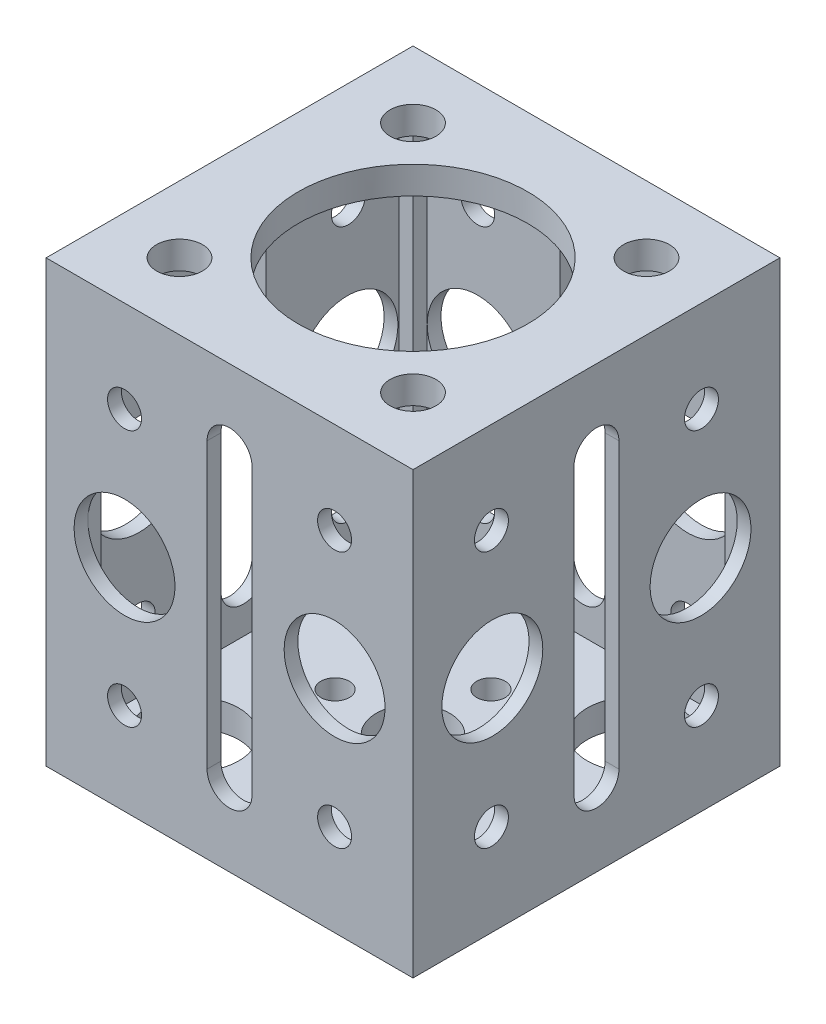
from build123d import *

# Parameters (mm, degrees)
SKETCH_1_W                = 40
SKETCH_1_H                = 40
SKETCH_1_R                = 1.55
EXTRUDE_2_DEPTH           = 3
SKETCH_1_6_R              = 4
CUT_EXTRUDE_1_DEPTH       = 1.5
SKETCH_2_W                = 3
SKETCH_2_H                = 3
EXTRUDE_7_DEPTH           = 45
SKETCH_5_W                = 40
SKETCH_5_H                = 3
EXTRUDE_8_DEPTH           = 40
CUT_EXTRUDE_2_DEPTH       = 4
CUT_EXTRUDE_START         = -4
SKETCH_7_R                = 4
CUT_EXTRUDE_3_DEPTH       = 4
SKETCH_8_R                = 5
CUT_EXTRUDE_4_DEPTH       = 4
SKETCH_9_R                = 2.5
CUT_EXTRUDE_5_DEPTH       = 4
SKETCH_10_W               = 1.5
SKETCH_10_H               = 34
SKETCH_10_W_2             = 34
SKETCH_10_H_2             = 1.5
EXTRUDE_10_DEPTH          = 45
CUT_EXTRUDE_12_DEPTH      = 63.507999488
CUT_EXTRUDE_12_DEPTH_BACK = 4
CUT_EXTRUDE_13_DEPTH      = 4
CUT_EXTRUDE_13_DEPTH_BACK = 64.442887702
CUT_EXTRUDE_15_DEPTH      = 10
CUT_EXTRUDE_15_DEPTH_BACK = 64.442887702
SKETCH_24_5_R             = 1.85
SKETCH_24_5_R_2           = 5.5
CUT_EXTRUDE_16_DEPTH      = 10
CUT_EXTRUDE_16_DEPTH_BACK = 64.442887702
SKETCH_25_R               = 5.5
SKETCH_25_R_2             = 1.85


with BuildPart() as part:
    # 草图1 → 凸台-拉伸2 (new body)
    with BuildSketch(Plane(origin=(0, 0, 0), x_dir=(1, 0, 0), z_dir=(0, 1, 0))):
        Rectangle(SKETCH_1_W, SKETCH_1_H)
        with Locations((0, 8.5)):
            Circle(SKETCH_1_R, mode=Mode.SUBTRACT)
        with Locations((8.5, 0)):
            Circle(SKETCH_1_R, mode=Mode.SUBTRACT)
        with Locations((0, -8.5)):
            Circle(SKETCH_1_R, mode=Mode.SUBTRACT)
        with Locations((-8.5, 0)):
            Circle(SKETCH_1_R, mode=Mode.SUBTRACT)
    extrude(amount=-EXTRUDE_2_DEPTH)

    # 草图1<6> → 切除-拉伸1 (cut)
    with BuildSketch(Plane(origin=(0, 0, 0), x_dir=(1, 0, 0), z_dir=(0, 1, 0))):
        Circle(SKETCH_1_6_R)
    extrude(amount=-CUT_EXTRUDE_1_DEPTH, mode=Mode.SUBTRACT)

    # 草图2 → 凸台-拉伸7 (add)
    with BuildSketch(Plane(origin=(0, 0, 0), x_dir=(1, 0, 0), z_dir=(0, 1, 0))):
        with Locations((-18.5, -18.5)):
            Rectangle(SKETCH_2_W, SKETCH_2_H)
        with Locations((18.5, -18.5)):
            Rectangle(SKETCH_2_W, SKETCH_2_H)
        with Locations((-18.5, 18.5)):
            Rectangle(SKETCH_2_W, SKETCH_2_H)
        with Locations((18.5, 18.5)):
            Rectangle(SKETCH_2_W, SKETCH_2_H)
    extrude(amount=EXTRUDE_7_DEPTH)

    # 草图5 → 凸台-拉伸8 (add)
    with BuildSketch(Plane.ZY.offset(20)):
        with Locations((0, 43.5)):
            Rectangle(SKETCH_5_W, SKETCH_5_H)
    extrude(amount=-EXTRUDE_8_DEPTH)

    # 草图6 → 切除-拉伸2 (cut)
    with BuildSketch(Plane(origin=(0, 45, 0), x_dir=(1, 0, 0), z_dir=(0, 1, 0))):
        with BuildLine():
            ThreePointArc((12.5, 0), (-8.838834765, 8.838834765), (0, -12.5))
            ThreePointArc((0, -12.5), (8.838834765, -8.838834765), (12.5, 0))
        make_face()
    extrude(amount=-CUT_EXTRUDE_2_DEPTH, mode=Mode.SUBTRACT)

    # 草图7 → 切除-拉伸3 (cut)
    with BuildSketch(Plane.XZ.offset(3).offset(CUT_EXTRUDE_START)):
        Circle(SKETCH_7_R)
    extrude(amount=CUT_EXTRUDE_3_DEPTH, mode=Mode.SUBTRACT)

    # 草图8 → 切除-拉伸4 (cut)
    with BuildSketch(Plane.XZ.offset(3)):
        with Locations((-12, 12)):
            Circle(SKETCH_8_R)
        with Locations((12, 12)):
            Circle(SKETCH_8_R)
        with Locations((12, -12)):
            Circle(SKETCH_8_R)
        with Locations((-12, -12)):
            Circle(SKETCH_8_R)
    extrude(amount=-CUT_EXTRUDE_4_DEPTH, mode=Mode.SUBTRACT)

    # 草图9 → 切除-拉伸5 (cut)
    with BuildSketch(Plane(origin=(0, 45, 0), x_dir=(1, 0, 0), z_dir=(0, 1, 0))):
        with Locations((-12.727922061, 12.727922061)):
            Circle(SKETCH_9_R)
        with Locations((12.727922061, 12.727922061)):
            Circle(SKETCH_9_R)
        with Locations((12.727922061, -12.727922061)):
            Circle(SKETCH_9_R)
        with Locations((-12.727922061, -12.727922061)):
            Circle(SKETCH_9_R)
    extrude(amount=-CUT_EXTRUDE_5_DEPTH, mode=Mode.SUBTRACT)

    # 草图10 → 凸台-拉伸10 (add)
    with BuildSketch(Plane(origin=(0, 0, 0), x_dir=(1, 0, 0), z_dir=(0, 1, 0))):
        with Locations((19.25, 0)):
            Rectangle(SKETCH_10_W, SKETCH_10_H)
        with Locations((0, -19.25)):
            Rectangle(SKETCH_10_W_2, SKETCH_10_H_2)
        with Locations((-19.25, 0)):
            Rectangle(SKETCH_10_W, SKETCH_10_H)
        with Locations((0, 19.25)):
            Rectangle(SKETCH_10_W_2, SKETCH_10_H_2)
    extrude(amount=EXTRUDE_10_DEPTH)

    # 草图20 → 切除-拉伸12 (cut, two sides: drawn at the far end of the back side and taken through both)
    with BuildSketch(Plane(origin=(0, 0, 18.5), x_dir=(-1, 0, 0), z_dir=(0, 0, -1)).offset(-CUT_EXTRUDE_12_DEPTH_BACK)):
        with BuildLine():
            Line((-2.45, 36.5), (-2.45, 5.5))
            ThreePointArc((-2.45, 5.5), (0, 3.05), (2.45, 5.5))
            Line((2.45, 5.5), (2.45, 36.5))
            ThreePointArc((2.45, 36.5), (0, 38.95), (-2.45, 36.5))
        make_face()
    extrude(amount=CUT_EXTRUDE_12_DEPTH + CUT_EXTRUDE_12_DEPTH_BACK, mode=Mode.SUBTRACT)

    # 草图24 → 切除-拉伸13 (cut, two sides: drawn at the far end of the back side and taken through both)
    with BuildSketch(Plane(origin=(20, 0, 0), x_dir=(0, 0, -1), z_dir=(1, 0, 0)).offset(-CUT_EXTRUDE_13_DEPTH_BACK)):
        with BuildLine():
            Line((-2.45, 36.5), (-2.45, 5.5))
            ThreePointArc((-2.45, 5.5), (0, 3.05), (2.45, 5.5))
            Line((2.45, 5.5), (2.45, 36.5))
            ThreePointArc((2.45, 36.5), (0, 38.95), (-2.45, 36.5))
        make_face()
    extrude(amount=CUT_EXTRUDE_13_DEPTH + CUT_EXTRUDE_13_DEPTH_BACK, mode=Mode.SUBTRACT)

    # 草图24<5> → 切除-拉伸15 (cut, two sides: drawn at the far end of the back side and taken through both)
    with BuildSketch(Plane(origin=(20, 0, 0), x_dir=(0, 0, -1), z_dir=(1, 0, 0)).offset(-CUT_EXTRUDE_15_DEPTH_BACK)):
        with Locations((-11.45, 35)):
            Circle(SKETCH_24_5_R)
        with Locations((-11.45, 7)):
            Circle(SKETCH_24_5_R)
        with Locations((11.45, 7)):
            Circle(SKETCH_24_5_R)
        with Locations((11.45, 35)):
            Circle(SKETCH_24_5_R)
        with Locations((-11.35, 21)):
            Circle(SKETCH_24_5_R_2)
        with Locations((11.35, 21)):
            Circle(SKETCH_24_5_R_2)
    extrude(amount=CUT_EXTRUDE_15_DEPTH + CUT_EXTRUDE_15_DEPTH_BACK, mode=Mode.SUBTRACT)

    # 草图25 → 切除-拉伸16 (cut, two sides: drawn at the far end of the back side and taken through both)
    with BuildSketch(Plane(origin=(0, 0, -20), x_dir=(-1, 0, 0), z_dir=(0, 0, -1)).offset(-CUT_EXTRUDE_16_DEPTH_BACK)):
        with Locations((-11.45, 21)):
            Circle(SKETCH_25_R)
        with Locations((-11.45, 35)):
            Circle(SKETCH_25_R_2)
        with Locations((11.45, 35)):
            Circle(SKETCH_25_R_2)
        with Locations((11.45, 7)):
            Circle(SKETCH_25_R_2)
        with Locations((-11.45, 7)):
            Circle(SKETCH_25_R_2)
        with Locations((11.45, 21)):
            Circle(SKETCH_25_R)
    extrude(amount=CUT_EXTRUDE_16_DEPTH + CUT_EXTRUDE_16_DEPTH_BACK, mode=Mode.SUBTRACT)


solid = part.part
